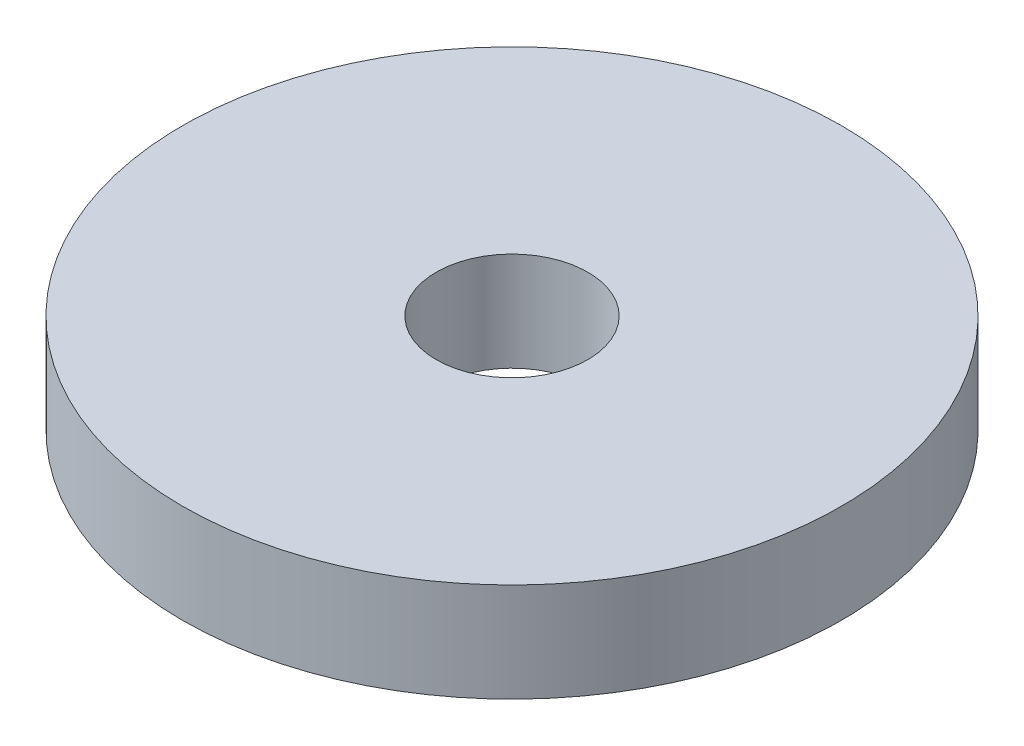
from build123d import *

# Parameters (mm, degrees)
SKETCH1_R           = 10
SKETCH1_R_2         = 2.3
BOSS_EXTRUDE1_DEPTH = 3


with BuildPart() as part:
    # Sketch1 → Boss-Extrude1 (new body)
    with BuildSketch(Plane(origin=(0, 0, 0), x_dir=(1, 0, 0), z_dir=(0, 1, 0))):
        with Locations(Location((0, 0, 0), (0, 0, 270))):
            Circle(SKETCH1_R)
        with Locations(Location((0, 0, 0), (0, 0, 270))):
            Circle(SKETCH1_R_2, mode=Mode.SUBTRACT)
    extrude(amount=BOSS_EXTRUDE1_DEPTH)


solid = part.part
